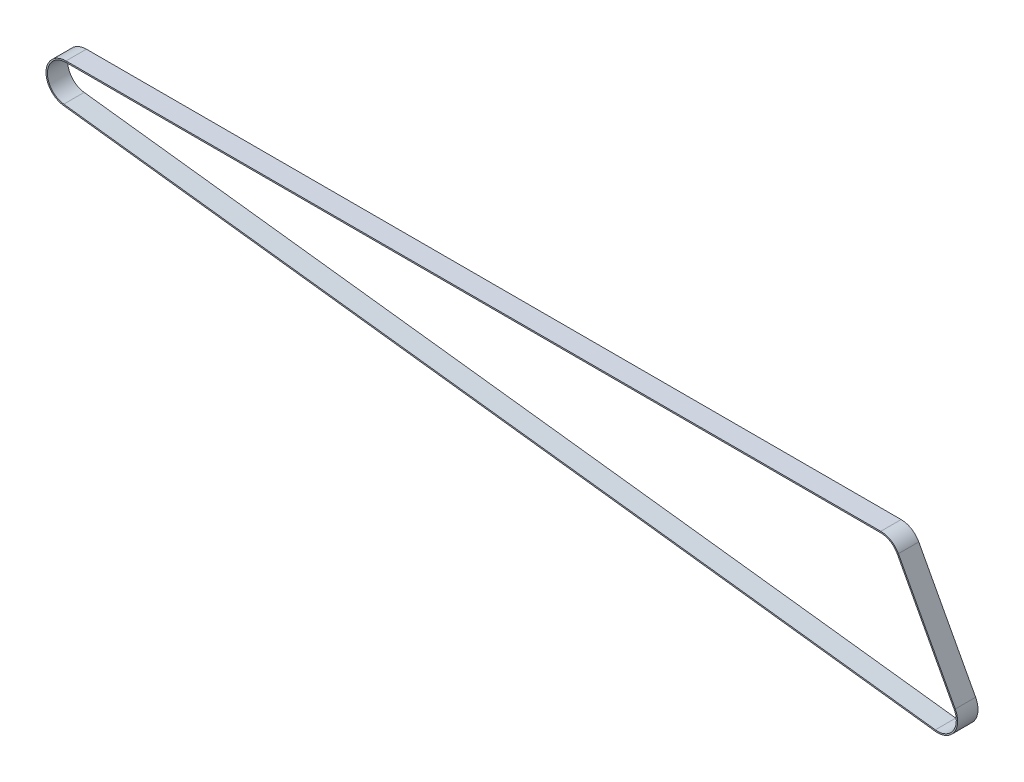
from build123d import *

# Parameters (mm, degrees)
LINEAR_AUSTRAGEN_D_NN1_DEPTH = 6


with BuildPart() as part:
    # Skizze1 → Linear-Austragen-Dünn1 (new, symmetric)
    with BuildSketch(Plane.XY):
        with BuildLine():
            Line((-240, 11.8), (240, 11.8))
            ThreePointArc((240, 11.8), (246.060554738, 10.124706231), (250.400226495, 5.574521401))
            Line((250.400226495, 5.574521401), (283.900226495, -56.925478599))
            ThreePointArc((283.900226495, -56.925478599), (283.239349482, -69.16221222), (272.074299499, -74.213555313))
            Line((272.074299499, -74.213555313), (-241.425700501, -11.713555313))
            ThreePointArc((-241.425700501, -11.713555313), (-251.778369002, 0.714159401), (-240, 11.8))
        make_face()
        with BuildLine():
            Line((-240, 11), (240, 11))
            ThreePointArc((240, 11), (245.649669671, 9.43828547), (249.695126394, 5.196587747))
            Line((249.695126394, 5.196587747), (283.195126394, -57.303412253))
            ThreePointArc((283.195126394, -57.303412253), (282.579054602, -68.710536816), (272.17095716, -73.41941597))
            Line((272.17095716, -73.41941597), (-241.32904284, -10.91941597))
            ThreePointArc((-241.32904284, -10.91941597), (-250.97983551, 0.665741815), (-240, 11))
        make_face(mode=Mode.SUBTRACT)
    extrude(amount=LINEAR_AUSTRAGEN_D_NN1_DEPTH, both=True)


solid = part.part
